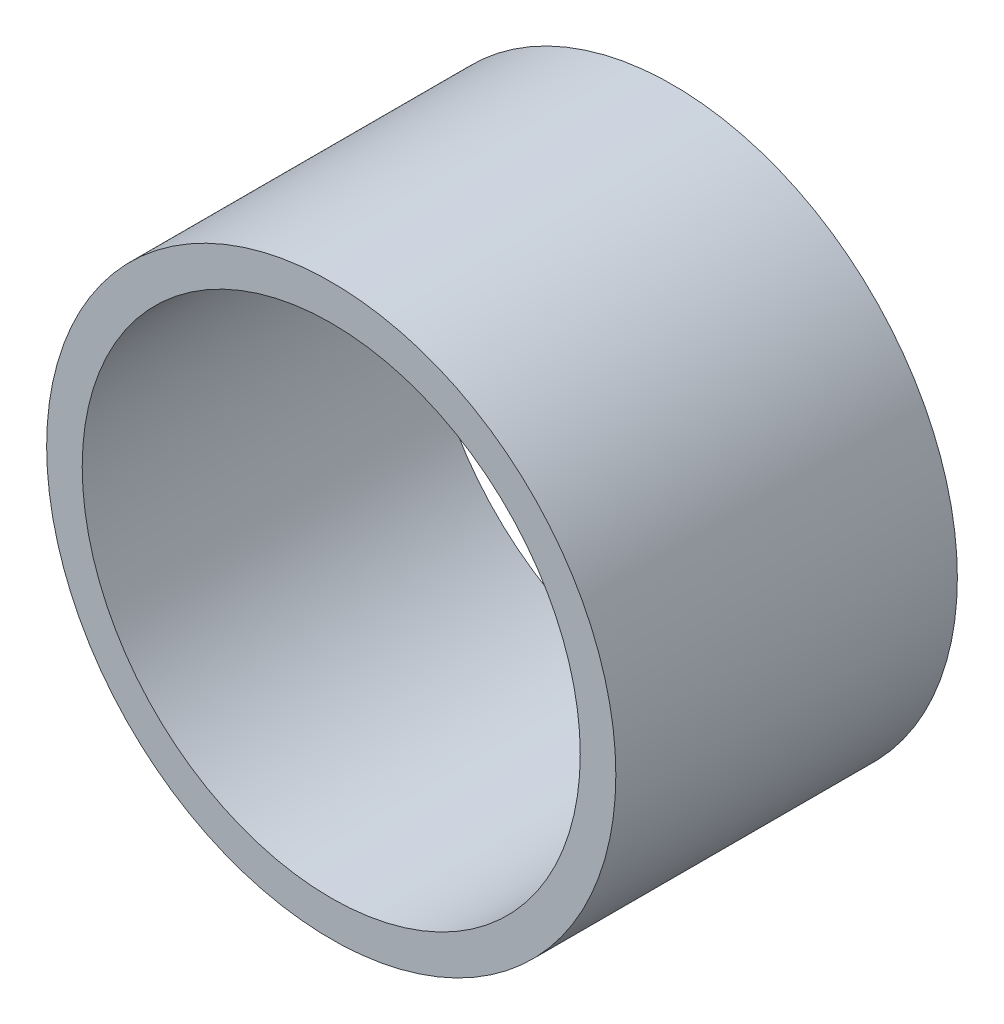
from build123d import *

# Parameters (mm, degrees)
SKETCH1_W = 1.25
SKETCH1_H = 12


with BuildPart() as part:
    # Sketch1 → Revolve1 (revolve)
    with BuildSketch(Plane(origin=(0, 0, 0), x_dir=(1, 0, 0), z_dir=(0, 1, 0)), mode=Mode.PRIVATE) as revolve1_sk:
        with Locations((9.375, 6)):
            Rectangle(SKETCH1_W, SKETCH1_H)
    revolve(revolve1_sk.sketch.rotate(Axis((0, 0, -12.511727079), (0, 0, 1)), 180), axis=Axis((0, 0, -12.511727079), (0, 0, 1)))


solid = part.part
